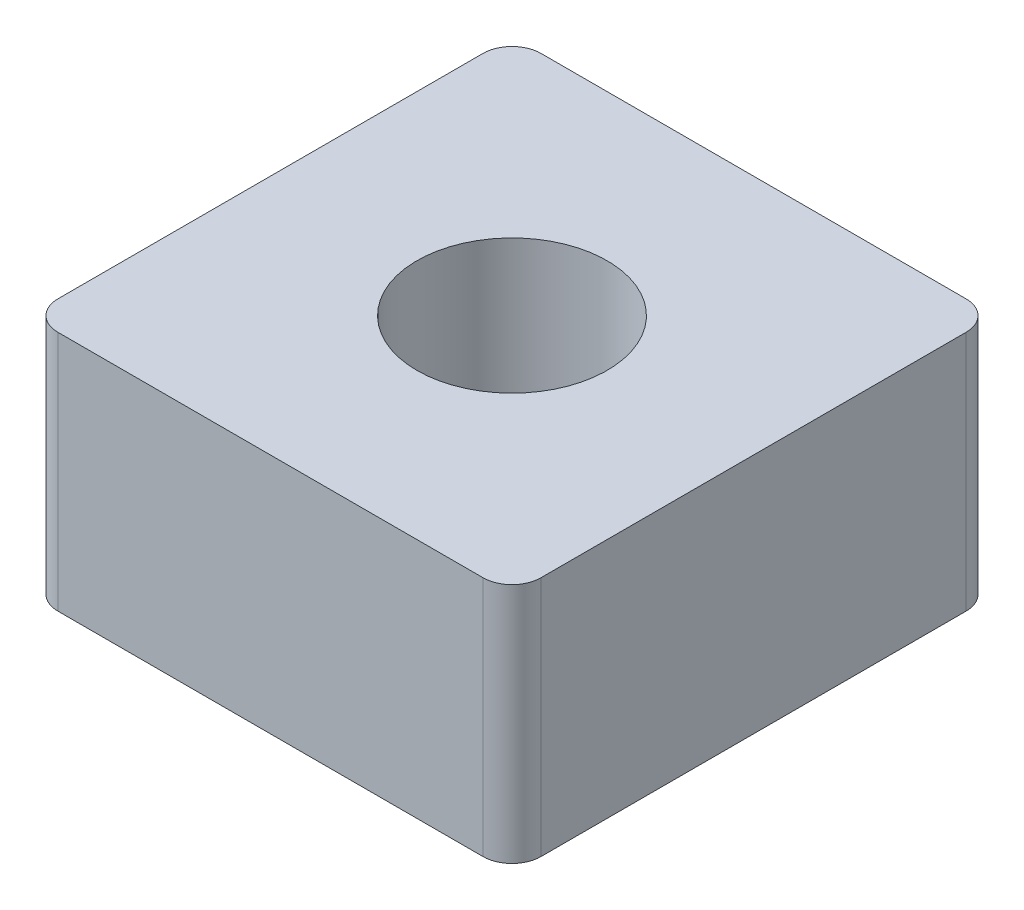
from build123d import *

# Parameters (mm, degrees)
BOSS_EXTRUDE1_DEPTH   = 6.35
M6X1_0_TAPPED_HOLE1_D = 5


with BuildPart() as part:
    # Sketch1 → Boss-Extrude1 (new body)
    with BuildSketch(Plane(origin=(0, 0, 0), x_dir=(1, 0, 0), z_dir=(0, 1, 0))):
        with BuildLine():
            Line((-5.588, -6.35), (5.588, -6.35))
            ThreePointArc((5.588, -6.35), (6.126815367, -6.126815367), (6.35, -5.588))
            Line((6.35, -5.588), (6.35, 5.588))
            ThreePointArc((6.35, 5.588), (6.126815367, 6.126815367), (5.588, 6.35))
            Line((5.588, 6.35), (-5.588, 6.35))
            ThreePointArc((-5.588, 6.35), (-6.126815367, 6.126815367), (-6.35, 5.588))
            Line((-6.35, 5.588), (-6.35, -5.588))
            ThreePointArc((-6.35, -5.588), (-6.126815367, -6.126815367), (-5.588, -6.35))
        make_face()
    extrude(amount=BOSS_EXTRUDE1_DEPTH)

    # M6x1.0 Tapped Hole1 (through all)
    with Locations(Plane(origin=(0, 6.35, 0), x_dir=(1, 0, 0), z_dir=(0, 1, 0))):
        with Locations((0, 0)):
            Hole(M6X1_0_TAPPED_HOLE1_D / 2)


solid = part.part
